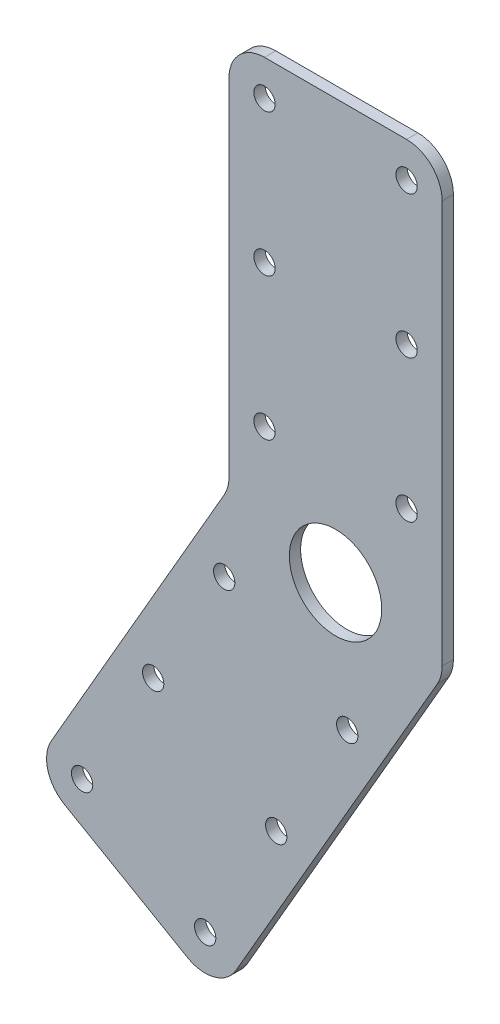
from build123d import *

# Parameters (mm, degrees)
SKETCH1_R           = 6.5
SKETCH1_R_2         = 1.5
BOSS_EXTRUDE1_DEPTH = 1.5875
FILLET1_R           = 5


with BuildPart() as part:
    # Sketch1 → Boss-Extrude1 (new body)
    with BuildSketch(Plane.XY):
        Polygon((0, 0), (0, 55), (30, 55), (30, -8.038475773), (-1.519237886, -62.631397208), (-27.5, -47.631397208), align=None)
        with Locations((15, -4.019237886)):
            Circle(SKETCH1_R, mode=Mode.SUBTRACT)
        with Locations((5, 50)):
            Circle(SKETCH1_R_2, mode=Mode.SUBTRACT)
        with Locations((5, 30)):
            Circle(SKETCH1_R_2, mode=Mode.SUBTRACT)
        with Locations((5, 10)):
            Circle(SKETCH1_R_2, mode=Mode.SUBTRACT)
        with Locations(Location((25, 10, 0), (0, 0, 180))):
            Circle(SKETCH1_R_2, mode=Mode.SUBTRACT)
        with Locations(Location((25, 30, 0), (0, 0, 180))):
            Circle(SKETCH1_R_2, mode=Mode.SUBTRACT)
        with Locations(Location((25, 50, 0), (0, 0, 180))):
            Circle(SKETCH1_R_2, mode=Mode.SUBTRACT)
        with Locations((-20.669872981, -45.801270189)):
            Circle(SKETCH1_R_2, mode=Mode.SUBTRACT)
        with Locations((-10.669872981, -28.480762114)):
            Circle(SKETCH1_R_2, mode=Mode.SUBTRACT)
        with Locations((-0.669872981, -11.160254038)):
            Circle(SKETCH1_R_2, mode=Mode.SUBTRACT)
        with Locations(Location((16.650635095, -21.160254038, 0), (0, 0, 180))):
            Circle(SKETCH1_R_2, mode=Mode.SUBTRACT)
        with Locations(Location((6.650635095, -38.480762114, 0), (0, 0, 180))):
            Circle(SKETCH1_R_2, mode=Mode.SUBTRACT)
        with Locations(Location((-3.349364905, -55.801270189, 0), (0, 0, 180))):
            Circle(SKETCH1_R_2, mode=Mode.SUBTRACT)
    extrude(amount=BOSS_EXTRUDE1_DEPTH)

    # Fillet1
    fillet1_edges = [part.edges().sort_by_distance(p)[0] for p in [
        (0, 0, 0.79375),
        (0, 55, 0.79375),
        (30, 55, 0.79375),
        (30, -8.038475773, 0.79375),
        (-1.519237886, -62.631397208, 0.79375),
        (-27.5, -47.631397208, 0.79375),
    ]]
    fillet(fillet1_edges, radius=FILLET1_R)


solid = part.part
